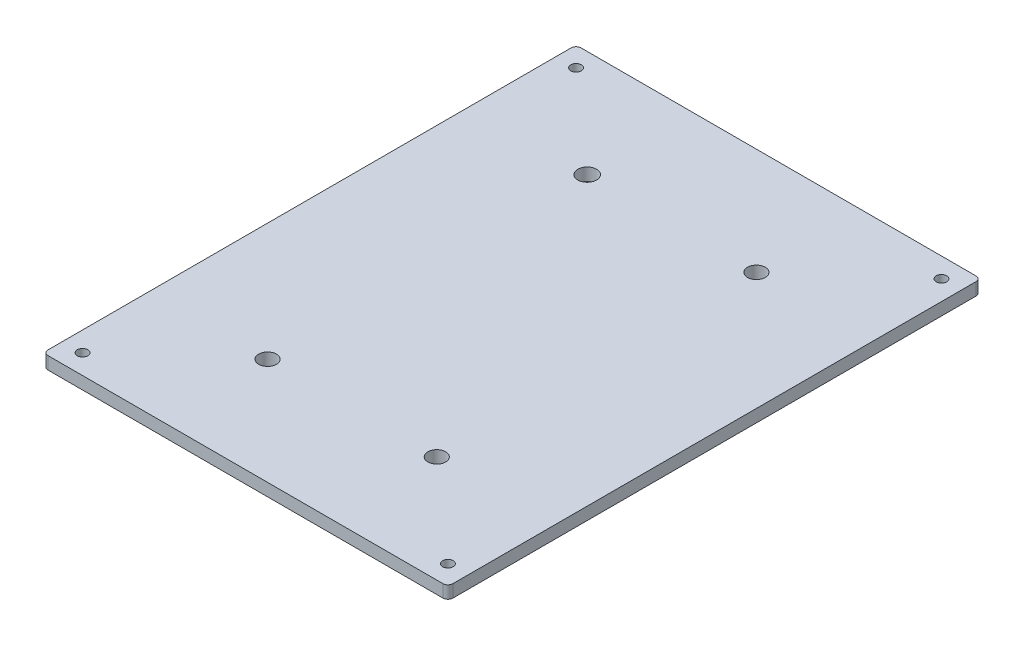
from build123d import *

# Parameters (mm, degrees)
SKETCH1_W           = 205.1
SKETCH1_H           = 270
BOSS_EXTRUDE1_DEPTH = 6.35
FILLET1_R           = 2.54
CUT_EXTRUDE2_REACH  = 171.652
SKETCH3_R           = 2.665
CUT_EXTRUDE3_REACH  = 171.652
SKETCH2_R           = 4.7625
SKETCH2_R_2         = 4.5


with BuildPart() as part:
    # Sketch1 → Boss-Extrude1 (new body)
    with BuildSketch(Plane(origin=(0, 0, 0), x_dir=(1, 0, 0), z_dir=(0, 1, 0))):
        Rectangle(SKETCH1_W, SKETCH1_H)
    extrude(amount=BOSS_EXTRUDE1_DEPTH)

    # Fillet1
    fillet1_edges = [part.edges().sort_by_distance(p)[0] for p in [
        (-102.55, 3.175, -135),
        (102.55, 3.175, -135),
        (102.55, 3.175, 135),
        (-102.55, 3.175, 135),
    ]]
    fillet(fillet1_edges, radius=FILLET1_R)

    # Sketch3 → Cut-Extrude2 (cut, up to next)
    with BuildSketch(Plane(origin=(0, 6.35, 0), x_dir=(-1, 0, 0), z_dir=(0, 1, 0)), mode=Mode.PRIVATE) as cut_extrude2_sk1:
        with Locations(Location((92.55, 125, 0), (0, 0, 90))):
            Circle(SKETCH3_R)
    cut_extrude2_tool1 = extrude(cut_extrude2_sk1.sketch, amount=-CUT_EXTRUDE2_REACH, mode=Mode.PRIVATE) & part.part
    # Sketch3 → Cut-Extrude2 (cut, up to next)
    with BuildSketch(Plane(origin=(0, 6.35, 0), x_dir=(-1, 0, 0), z_dir=(0, 1, 0)), mode=Mode.PRIVATE) as cut_extrude2_sk2:
        with Locations(Location((-92.55, 125, 0), (0, 0, 90))):
            Circle(SKETCH3_R)
    cut_extrude2_tool2 = extrude(cut_extrude2_sk2.sketch, amount=-CUT_EXTRUDE2_REACH, mode=Mode.PRIVATE) & part.part
    # Sketch3 → Cut-Extrude2 (cut, up to next)
    with BuildSketch(Plane(origin=(0, 6.35, 0), x_dir=(-1, 0, 0), z_dir=(0, 1, 0)), mode=Mode.PRIVATE) as cut_extrude2_sk3:
        with Locations(Location((-92.55, -125, 0), (0, 0, 90))):
            Circle(SKETCH3_R)
    cut_extrude2_tool3 = extrude(cut_extrude2_sk3.sketch, amount=-CUT_EXTRUDE2_REACH, mode=Mode.PRIVATE) & part.part
    # Sketch3 → Cut-Extrude2 (cut, up to next)
    with BuildSketch(Plane(origin=(0, 6.35, 0), x_dir=(-1, 0, 0), z_dir=(0, 1, 0)), mode=Mode.PRIVATE) as cut_extrude2_sk4:
        with Locations(Location((92.55, -125, 0), (0, 0, 90))):
            Circle(SKETCH3_R)
    cut_extrude2_tool4 = extrude(cut_extrude2_sk4.sketch, amount=-CUT_EXTRUDE2_REACH, mode=Mode.PRIVATE) & part.part
    add(cut_extrude2_tool1.solids().sort_by_distance((-92.55, 6.35, 125))[0], mode=Mode.SUBTRACT)
    add(cut_extrude2_tool2.solids().sort_by_distance((92.55, 6.35, 125))[0], mode=Mode.SUBTRACT)
    add(cut_extrude2_tool3.solids().sort_by_distance((92.55, 6.35, -125))[0], mode=Mode.SUBTRACT)
    add(cut_extrude2_tool4.solids().sort_by_distance((-92.55, 6.35, -125))[0], mode=Mode.SUBTRACT)

    # Sketch2 → Cut-Extrude3 (cut, up to next)
    with BuildSketch(Plane(origin=(0, 6.35, 0), x_dir=(1, 0, 0), z_dir=(0, 1, 0)), mode=Mode.PRIVATE) as cut_extrude3_sk1:
        with Locations(Location((-42.8625, 80.9625, 0), (0, 0, 270))):
            Circle(SKETCH2_R)
    cut_extrude3_tool1 = extrude(cut_extrude3_sk1.sketch, amount=-CUT_EXTRUDE3_REACH, mode=Mode.PRIVATE) & part.part
    # Sketch2 → Cut-Extrude3 (cut, up to next)
    with BuildSketch(Plane(origin=(0, 6.35, 0), x_dir=(1, 0, 0), z_dir=(0, 1, 0)), mode=Mode.PRIVATE) as cut_extrude3_sk2:
        with Locations(Location((-42.8625, -80.9625, 0), (0, 0, 270))):
            Circle(SKETCH2_R_2)
    cut_extrude3_tool2 = extrude(cut_extrude3_sk2.sketch, amount=-CUT_EXTRUDE3_REACH, mode=Mode.PRIVATE) & part.part
    # Sketch2 → Cut-Extrude3 (cut, up to next)
    with BuildSketch(Plane(origin=(0, 6.35, 0), x_dir=(1, 0, 0), z_dir=(0, 1, 0)), mode=Mode.PRIVATE) as cut_extrude3_sk3:
        with Locations(Location((42.8625, -80.9625, 0), (0, 0, 270))):
            Circle(SKETCH2_R_2)
    cut_extrude3_tool3 = extrude(cut_extrude3_sk3.sketch, amount=-CUT_EXTRUDE3_REACH, mode=Mode.PRIVATE) & part.part
    # Sketch2 → Cut-Extrude3 (cut, up to next)
    with BuildSketch(Plane(origin=(0, 6.35, 0), x_dir=(1, 0, 0), z_dir=(0, 1, 0)), mode=Mode.PRIVATE) as cut_extrude3_sk4:
        with Locations(Location((42.8625, 80.9625, 0), (0, 0, 270))):
            Circle(SKETCH2_R_2)
    cut_extrude3_tool4 = extrude(cut_extrude3_sk4.sketch, amount=-CUT_EXTRUDE3_REACH, mode=Mode.PRIVATE) & part.part
    add(cut_extrude3_tool1.solids().sort_by_distance((-42.8625, 6.35, -80.9625))[0], mode=Mode.SUBTRACT)
    add(cut_extrude3_tool2.solids().sort_by_distance((-42.8625, 6.35, 80.9625))[0], mode=Mode.SUBTRACT)
    add(cut_extrude3_tool3.solids().sort_by_distance((42.8625, 6.35, 80.9625))[0], mode=Mode.SUBTRACT)
    add(cut_extrude3_tool4.solids().sort_by_distance((42.8625, 6.35, -80.9625))[0], mode=Mode.SUBTRACT)


solid = part.part
